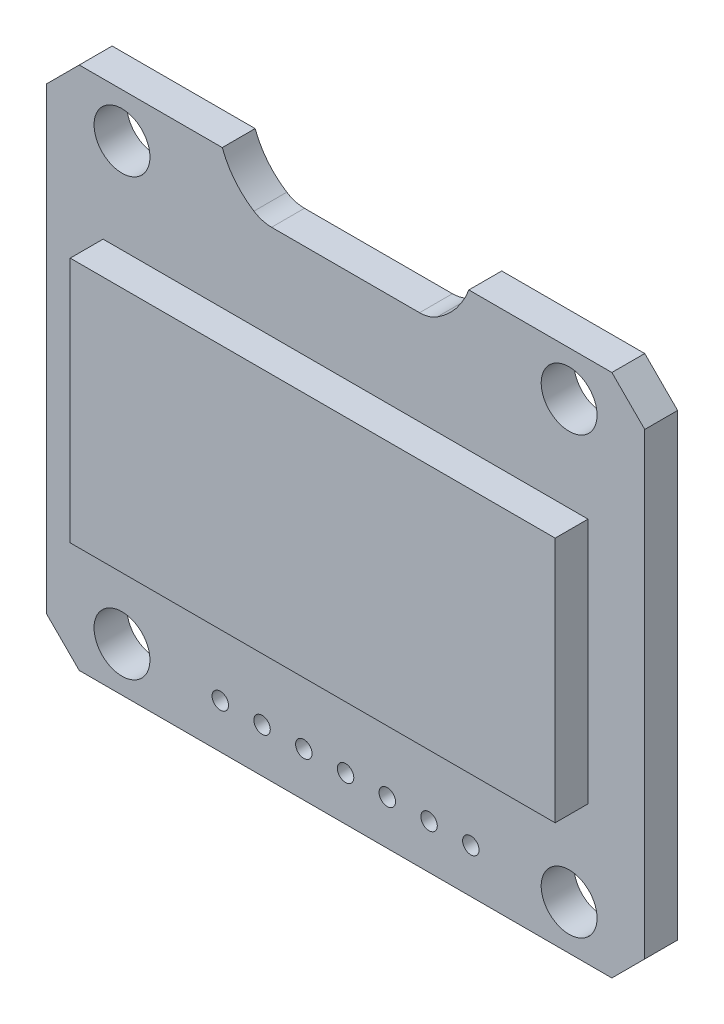
from build123d import *

# Parameters (mm, degrees)
SKETCH_1_W          = 36.4
SKETCH_1_H          = 31.9
EXTRUDE_1_DEPTH     = 2
SKETCH_2_W          = 29.5
SKETCH_2_H          = 15
EXTRUDE_2_DEPTH     = 2
SKETCH_3_R          = 1.7
CUT_EXTRUDE_2_DEPTH = 2
CUT_EXTRUDE_3_DEPTH = 2
SKETCH_5_R          = 0.5
CUT_EXTRUDE_4_DEPTH = 30
CUT_EXTRUDE_5_DEPTH = 10
FILLET_1_R          = 2


with BuildPart() as part:
    # 草图1 → 凸台-拉伸1 (new body)
    with BuildSketch(Plane.XY):
        Rectangle(SKETCH_1_W, SKETCH_1_H)
    extrude(amount=EXTRUDE_1_DEPTH)

    # 草图2 → 凸台-拉伸2 (add)
    with BuildSketch(Plane.XY.offset(2)):
        Rectangle(SKETCH_2_W, SKETCH_2_H)
    extrude(amount=EXTRUDE_2_DEPTH)

    # 草图3 → 切除-拉伸2 (cut)
    with BuildSketch(Plane.XY.offset(2)):
        with Locations((-13.6, 13.25)):
            Circle(SKETCH_3_R)
        with Locations(Location((13.6, 13.25, 0), (0, 0, 180))):
            Circle(SKETCH_3_R)
        with Locations((13.6, -13.25)):
            Circle(SKETCH_3_R)
        with Locations(Location((-13.6, -13.25, 0), (0, 0, 180))):
            Circle(SKETCH_3_R)
    extrude(amount=-CUT_EXTRUDE_2_DEPTH, mode=Mode.SUBTRACT)

    # 草图4 → 切除-拉伸3 (cut)
    with BuildSketch(Plane.XY.offset(2)):
        Polygon((-16.2, 15.95), (-18.2, 13.95), (-18.2, 15.95), align=None)
        Polygon((18.2, 13.95), (18.2, 15.95), (16.2, 15.95), align=None)
        Polygon((16.2, -15.95), (18.2, -13.95), (18.2, -15.95), align=None)
        Polygon((-18.2, -13.95), (-18.2, -15.95), (-16.2, -15.95), align=None)
    extrude(amount=-CUT_EXTRUDE_3_DEPTH, mode=Mode.SUBTRACT)

    # 草图5 → 切除-拉伸4 (cut)
    with BuildSketch(Plane.XY.offset(2)):
        with Locations((-7.62, -13.25)):
            Circle(SKETCH_5_R)
        with Locations((-5.08, -13.25)):
            Circle(SKETCH_5_R)
        with Locations((-2.54, -13.25)):
            Circle(SKETCH_5_R)
        with Locations((0, -13.25)):
            Circle(SKETCH_5_R)
        with Locations((2.54, -13.25)):
            Circle(SKETCH_5_R)
        with Locations((5.08, -13.25)):
            Circle(SKETCH_5_R)
        with Locations((7.62, -13.25)):
            Circle(SKETCH_5_R)
    extrude(amount=-CUT_EXTRUDE_4_DEPTH, mode=Mode.SUBTRACT)

    # 草图6 → 切除-拉伸5 (cut)
    with BuildSketch(Plane.XY.offset(2)):
        with BuildLine():
            Line((-5, 13.25), (5, 13.25))
            ThreePointArc((5, 13.25), (6.519232871, 14.350710305), (7.5, 15.95))
            Line((7.5, 15.95), (-7.5, 15.95))
            ThreePointArc((-7.5, 15.95), (-6.519232871, 14.350710305), (-5, 13.25))
        make_face()
    extrude(amount=-CUT_EXTRUDE_5_DEPTH, mode=Mode.SUBTRACT)

    # 圆角1
    fillet_1_edges = [part.edges().sort_by_distance(p)[0] for p in [
        (-5, 13.25, 1),
        (5, 13.25, 1),
    ]]
    fillet(fillet_1_edges, radius=FILLET_1_R)


solid = part.part
